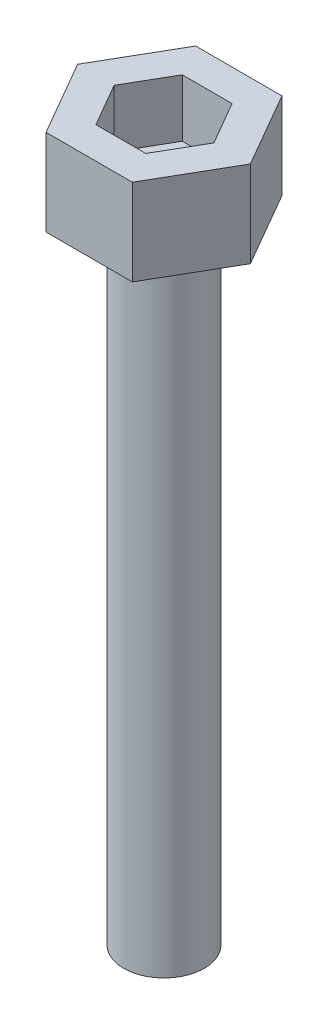
from build123d import *

# Parameters (mm, degrees)
SKETCH1_R           = 1.4
BOSS_EXTRUDE1_DEPTH = 22
BOSS_EXTRUDE2_DEPTH = 3
CUT_EXTRUDE1_DEPTH  = 2


with BuildPart() as part:
    # Sketch1 → Boss-Extrude1 (new body)
    with BuildSketch(Plane(origin=(0, 0, 0), x_dir=(1, 0, 0), z_dir=(0, 1, 0))):
        with Locations(Location((0, 0, 0), (0, 0, 270))):
            Circle(SKETCH1_R)
    extrude(amount=BOSS_EXTRUDE1_DEPTH)

    # Sketch2 → Boss-Extrude2 (add)
    with BuildSketch(Plane(origin=(0, 22, 0), x_dir=(1, 0, 0), z_dir=(0, 1, 0))):
        Polygon((3, 0), (1.5, 2.598076211), (-1.5, 2.598076211), (-3, 0), (-1.5, -2.598076211), (1.5, -2.598076211), align=None)
    extrude(amount=BOSS_EXTRUDE2_DEPTH)

    # Sketch3 → Cut-Extrude1 (cut)
    with BuildSketch(Plane(origin=(0, 25, 0), x_dir=(1, 0, 0), z_dir=(0, 1, 0))):
        Polygon((1.732050808, 0), (0.866025404, 1.5), (-0.866025404, 1.5), (-1.732050808, 0), (-0.866025404, -1.5), (0.866025404, -1.5), align=None)
    extrude(amount=-CUT_EXTRUDE1_DEPTH, mode=Mode.SUBTRACT)


solid = part.part
